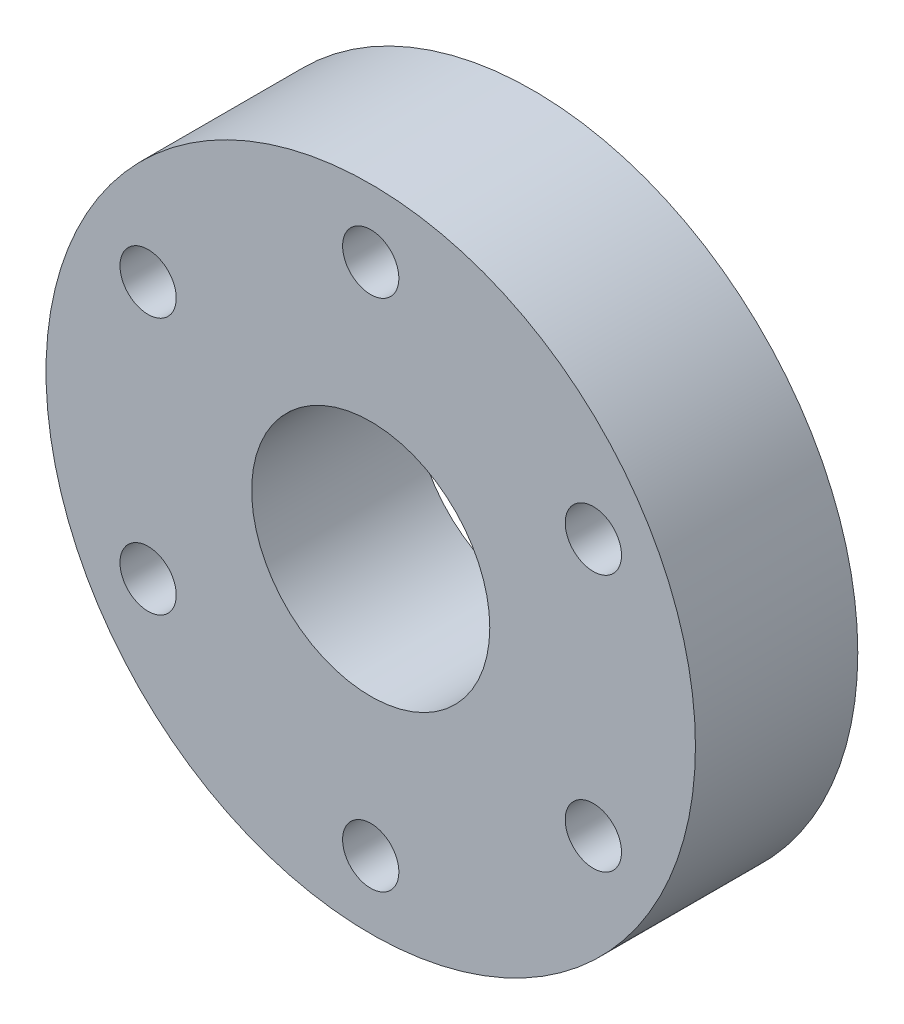
from build123d import *

# Parameters (mm, degrees)
SKETCH1_R           = 30
SKETCH1_R_2         = 2.6
SKETCH1_R_3         = 11
BOSS_EXTRUDE1_DEPTH = 15


with BuildPart() as part:
    # Sketch1 → Boss-Extrude1 (new body)
    with BuildSketch(Plane.XY):
        Circle(SKETCH1_R)
        with Locations((0, 23.75)):
            Circle(SKETCH1_R_2, mode=Mode.SUBTRACT)
        with Locations((20.56810334, 11.875)):
            Circle(SKETCH1_R_2, mode=Mode.SUBTRACT)
        with Locations((20.56810334, -11.875)):
            Circle(SKETCH1_R_2, mode=Mode.SUBTRACT)
        with Locations((0, -23.75)):
            Circle(SKETCH1_R_2, mode=Mode.SUBTRACT)
        with Locations((-20.56810334, -11.875)):
            Circle(SKETCH1_R_2, mode=Mode.SUBTRACT)
        with Locations((-20.56810334, 11.875)):
            Circle(SKETCH1_R_2, mode=Mode.SUBTRACT)
        Circle(SKETCH1_R_3, mode=Mode.SUBTRACT)
    extrude(amount=BOSS_EXTRUDE1_DEPTH)


solid = part.part
